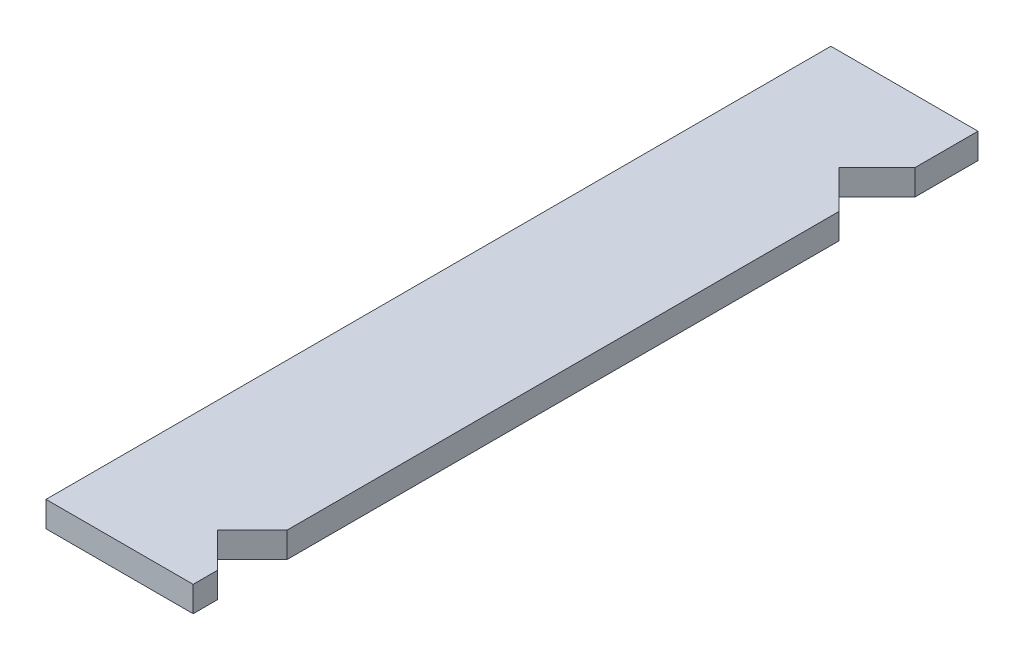
from build123d import *

# Parameters (mm, degrees)
SKETCH1_W           = 30
SKETCH1_H           = 160
BOSS_EXTRUDE1_DEPTH = 5.2
CUT_EXTRUDE1_DEPTH  = 10


with BuildPart() as part:
    # Sketch1 → Boss-Extrude1 (new body)
    with BuildSketch(Plane(origin=(0, 0, 0), x_dir=(1, 0, 0), z_dir=(0, 1, 0))):
        with Locations((15, 80)):
            Rectangle(SKETCH1_W, SKETCH1_H)
    extrude(amount=BOSS_EXTRUDE1_DEPTH)

    # Sketch2 → Cut-Extrude1 (cut)
    with BuildSketch(Plane(origin=(0, 5.2, 0), x_dir=(1, 0, 0), z_dir=(0, 1, 0))):
        Polygon((30, 131.642135624), (22.221825407, 139.420310217), (30, 147.19848481), align=None)
        Polygon((30, 19.142135624), (22.928932188, 12.071067812), (30, 5), align=None)
    extrude(amount=-CUT_EXTRUDE1_DEPTH, mode=Mode.SUBTRACT)


solid = part.part
